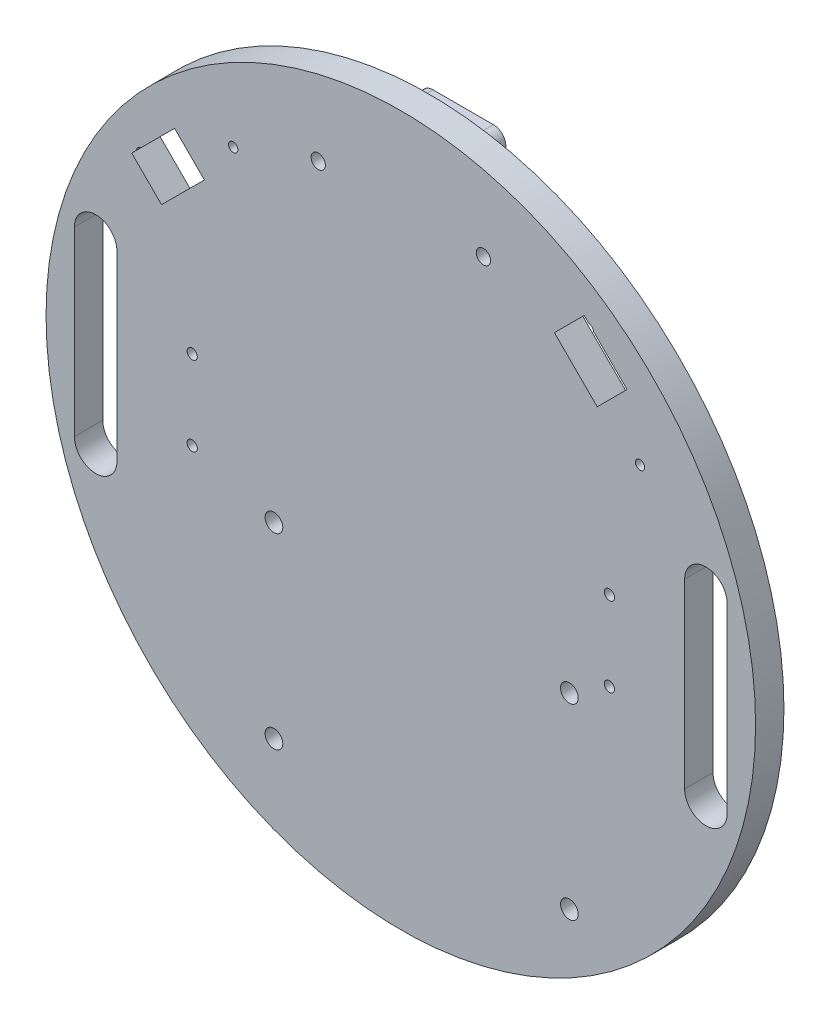
from build123d import *

# Parameters (mm, degrees)
MASTER_R            = 79.375
MASTER_R_2          = 1.984375
MASTER_R_3          = 1.143
MASTER_R_4          = 1.0414
MASTER_R_5          = 1.6002
BOSS_EXTRUDE1_DEPTH = 6.35
SKETCH11_R          = 1.143
BOSS_EXTRUDE3_DEPTH = 7.62
SKETCH13_W          = 13.5382
SKETCH13_H          = 5.08
CUT_EXTRUDE1_DEPTH  = 173.000625072


with BuildPart() as part:
    # Master → Boss-Extrude1 (new body)
    with BuildSketch(Plane.XY):
        Circle(MASTER_R)
        with Locations((-28.39, -56.515)):
            Circle(MASTER_R_2, mode=Mode.SUBTRACT)
        with BuildLine():
            ThreePointArc((-73.025, 20.32), (-68.2625, 25.0825), (-63.5, 20.32))
            Line((-63.5, 20.32), (-63.5, -20.32))
            ThreePointArc((-63.5, -20.32), (-68.2625, -25.0825), (-73.025, -20.32))
            Line((-73.025, -20.32), (-73.025, 20.32))
        make_face(mode=Mode.SUBTRACT)
        with Locations((-46.6725, -8.89)):
            Circle(MASTER_R_3, mode=Mode.SUBTRACT)
        with Locations((-28.39, -14.615)):
            Circle(MASTER_R_2, mode=Mode.SUBTRACT)
        with Locations((37.71, -56.515)):
            Circle(MASTER_R_2, mode=Mode.SUBTRACT)
        with Locations((37.71, -14.615)):
            Circle(MASTER_R_2, mode=Mode.SUBTRACT)
        with Locations((46.6725, -8.89)):
            Circle(MASTER_R_3, mode=Mode.SUBTRACT)
        with BuildLine():
            Line((63.5, -20.32), (63.5, 20.32))
            ThreePointArc((63.5, 20.32), (68.2625, 25.0825), (73.025, 20.32))
            Line((73.025, 20.32), (73.025, -20.32))
            ThreePointArc((73.025, -20.32), (68.2625, -25.0825), (63.5, -20.32))
        make_face(mode=Mode.SUBTRACT)
        with Locations((-46.6725, 8.89)):
            Circle(MASTER_R_3, mode=Mode.SUBTRACT)
        with BuildLine():
            Line((-43.949373457, 43.949373457), (-53.531306738, 34.367440175))
            Line((-53.531306738, 34.367440175), (-60.200586388, 41.036719826))
            Line((-60.200586388, 41.036719826), (-59.13351137, 42.103794844))
            ThreePointArc((-59.13351137, 42.103794844), (-58.829657849, 42.790920417), (-58.142532276, 43.094773938))
            Line((-58.142532276, 43.094773938), (-50.618653107, 50.618653107))
            Line((-50.618653107, 50.618653107), (-43.949373457, 43.949373457))
        make_face(mode=Mode.SUBTRACT)
        with Locations((-37.492569305, 53.531306738)):
            Circle(MASTER_R_4, mode=Mode.SUBTRACT)
        with Locations((-18.478499634, 60.3123)):
            Circle(MASTER_R_5, mode=Mode.SUBTRACT)
        with Locations((46.6725, 8.89)):
            Circle(MASTER_R_3, mode=Mode.SUBTRACT)
        with Locations((53.531306738, 37.492569305)):
            Circle(MASTER_R_4, mode=Mode.SUBTRACT)
        with Locations((18.478500366, 60.3123)):
            Circle(MASTER_R_5, mode=Mode.SUBTRACT)
        with BuildLine():
            Line((43.949373457, 43.949373457), (34.367440175, 53.531306738))
            Line((34.367440175, 53.531306738), (41.036719826, 60.200586388))
            Line((41.036719826, 60.200586388), (42.103794844, 59.13351137))
            ThreePointArc((42.103794844, 59.13351137), (42.790920417, 58.829657849), (43.094773938, 58.142532276))
            Line((43.094773938, 58.142532276), (50.618653107, 50.618653107))
            Line((50.618653107, 50.618653107), (43.949373457, 43.949373457))
        make_face(mode=Mode.SUBTRACT)
    extrude(amount=BOSS_EXTRUDE1_DEPTH)

    # Sketch11 → Boss-Extrude3 (add)
    # profile 1 of 2: a face of its own
    with BuildSketch(Plane.XY):
        with BuildLine():
            Line((6.7691, 67.5132), (-6.7691, 67.5132))
            ThreePointArc((-6.7691, 67.5132), (-9.525, 70.2691), (-6.7691, 73.025))
            Line((-6.7691, 73.025), (6.7691, 73.025))
            ThreePointArc((6.7691, 73.025), (9.525, 70.2691), (6.7691, 67.5132))
        make_face()
        with Locations((-6.7691, 70.2691)):
            Circle(SKETCH11_R, mode=Mode.SUBTRACT)
        with Locations((6.7691, 70.2691)):
            Circle(SKETCH11_R, mode=Mode.SUBTRACT)
    # profile 2 of 2: a face of its own
    with BuildSketch(Plane.XY):
        with BuildLine():
            Line((6.7691, -67.5132), (-6.7691, -67.5132))
            ThreePointArc((-6.7691, -67.5132), (-9.525, -70.2691), (-6.7691, -73.025))
            Line((-6.7691, -73.025), (6.7691, -73.025))
            ThreePointArc((6.7691, -73.025), (9.525, -70.2691), (6.7691, -67.5132))
        make_face()
        with Locations((6.7691, -70.2691)):
            Circle(SKETCH11_R, mode=Mode.SUBTRACT)
        with Locations((-6.7691, -70.2691)):
            Circle(SKETCH11_R, mode=Mode.SUBTRACT)
    extrude(amount=-BOSS_EXTRUDE3_DEPTH)

    # Sketch13 → Cut-Extrude1 (cut, through all)
    with BuildSketch(Plane(origin=(0, 73.025, 0), x_dir=(1, 0, 0), z_dir=(0, 1, 0))):
        with Locations((0, 2.54)):
            Rectangle(SKETCH13_W, SKETCH13_H)
    extrude(amount=-CUT_EXTRUDE1_DEPTH, mode=Mode.SUBTRACT)


solid = part.part
